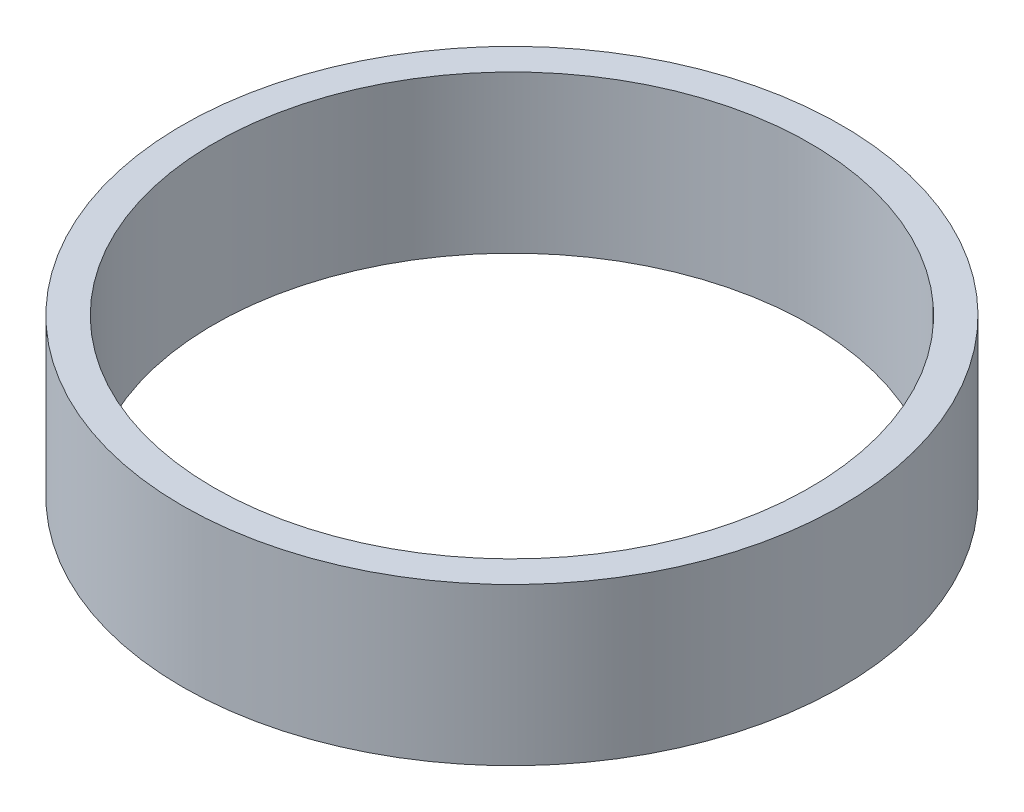
from build123d import *

# Parameters (mm, degrees)
SKETCH1_R           = 21
SKETCH1_R_2         = 19
BOSS_EXTRUDE2_DEPTH = 1
SKETCH2_R           = 21
SKETCH2_R_2         = 19
BOSS_EXTRUDE3_DEPTH = 9


with BuildPart() as part:
    # Sketch1 → Boss-Extrude2 (new body)
    with BuildSketch(Plane(origin=(0, 0, 0), x_dir=(1, 0, 0), z_dir=(0, 1, 0))):
        with Locations(Location((0, 0, 0), (0, 0, 270))):
            Circle(SKETCH1_R)
        with Locations(Location((0, 0, 0), (0, 0, 270))):
            Circle(SKETCH1_R_2, mode=Mode.SUBTRACT)
    extrude(amount=BOSS_EXTRUDE2_DEPTH)

    # Sketch2 → Boss-Extrude3 (add)
    with BuildSketch(Plane(origin=(0, 1, 0), x_dir=(1, 0, 0), z_dir=(0, 1, 0))):
        with Locations(Location((0, 0, 0), (0, 0, 270))):
            Circle(SKETCH2_R)
        with Locations(Location((0, 0, 0), (0, 0, 270))):
            Circle(SKETCH2_R_2, mode=Mode.SUBTRACT)
    extrude(amount=BOSS_EXTRUDE3_DEPTH)


solid = part.part
